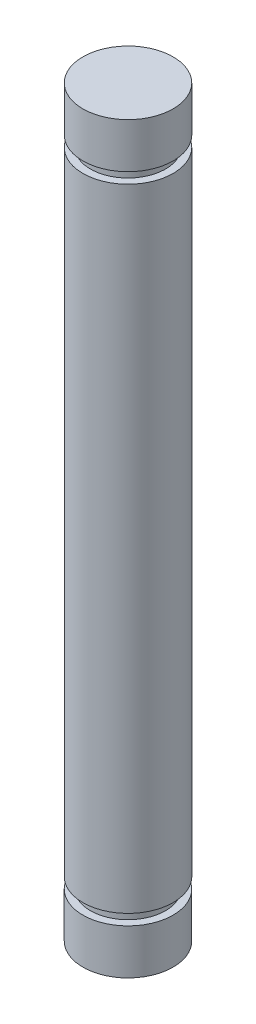
from build123d import *

# Parameters (mm, degrees)
SKETCH1_R           = 3.175
BOSS_EXTRUDE1_DEPTH = 44.45
SKETCH3_R           = 2.6416
BOSS_EXTRUDE2_DEPTH = 0.762
SKETCH4_R           = 3.175
BOSS_EXTRUDE3_DEPTH = 3.175
BOSS_EXTRUDE4_START = 0.762
SKETCH5_R           = 2.6416
BOSS_EXTRUDE4_DEPTH = 0.762
BOSS_EXTRUDE5_START = 3.175
SKETCH6_R           = 3.175
BOSS_EXTRUDE5_DEPTH = 3.175


with BuildPart() as part:
    # Sketch1 → Boss-Extrude1 (new body)
    with BuildSketch(Plane(origin=(0, 0, 0), x_dir=(1, 0, 0), z_dir=(0, 1, 0))):
        with Locations(Location((0, 0, 0), (0, 0, 270))):
            Circle(SKETCH1_R)
    extrude(amount=BOSS_EXTRUDE1_DEPTH)

    # Sketch3 → Boss-Extrude2 (add)
    with BuildSketch(Plane(origin=(0, 44.45, 0), x_dir=(1, 0, 0), z_dir=(0, 1, 0))):
        with Locations(Location((0, 0, 0), (0, 0, 90))):
            Circle(SKETCH3_R)
    extrude(amount=BOSS_EXTRUDE2_DEPTH)

    # Sketch4 → Boss-Extrude3 (add)
    with BuildSketch(Plane(origin=(0, 45.212, 0), x_dir=(1, 0, 0), z_dir=(0, 1, 0))):
        with Locations(Location((0, 0, 0), (0, 0, 270))):
            Circle(SKETCH4_R)
    extrude(amount=BOSS_EXTRUDE3_DEPTH)

    # Sketch5 → Boss-Extrude4 (add)
    with BuildSketch(Plane.XZ.offset(BOSS_EXTRUDE4_START)):
        with Locations(Location((0, 0, 0), (0, 0, 270))):
            Circle(SKETCH5_R)
    extrude(amount=-BOSS_EXTRUDE4_DEPTH)

    # Sketch6 → Boss-Extrude5 (add)
    with BuildSketch(Plane.XZ.offset(0.762).offset(BOSS_EXTRUDE5_START)):
        with Locations(Location((0, 0, 0), (0, 0, 90))):
            Circle(SKETCH6_R)
    extrude(amount=-BOSS_EXTRUDE5_DEPTH)


solid = part.part
